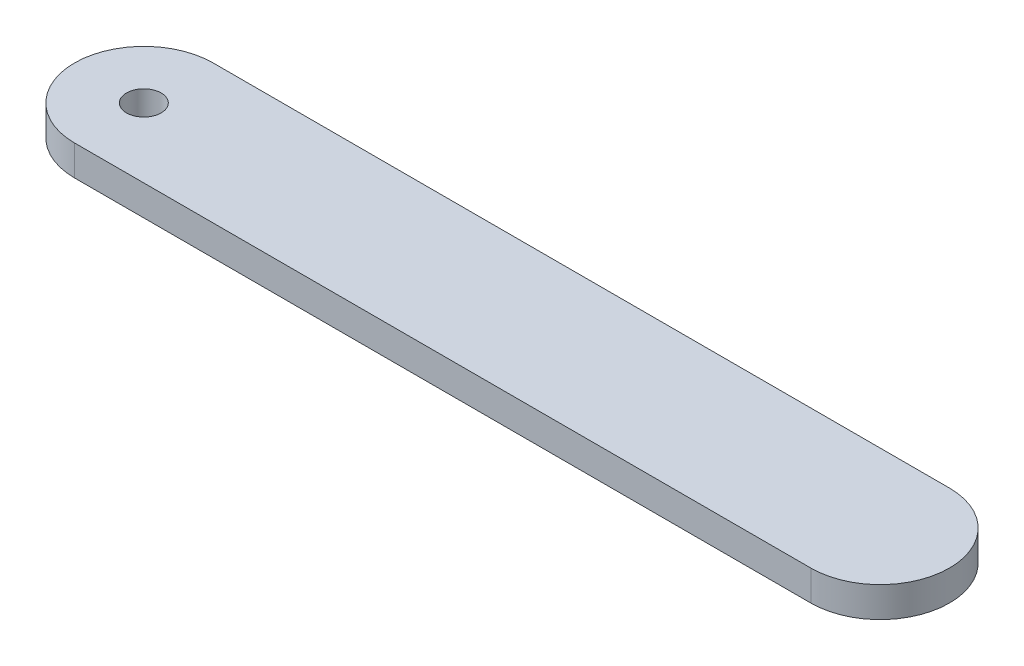
from build123d import *

# Parameters (mm, degrees)
BOSS_EXTRUDE1_DEPTH = 3.5
SKETCH2_R           = 2
CUT_EXTRUDE1_DEPTH  = 3.5


with BuildPart() as part:
    # Sketch1 → Boss-Extrude1 (new body)
    with BuildSketch(Plane(origin=(0, 0, 0), x_dir=(1, 0, 0), z_dir=(0, 1, 0))):
        with BuildLine():
            Line((0, 8), (85, 8))
            ThreePointArc((85, 8), (93, 0), (85, -8))
            Line((85, -8), (0, -8))
            ThreePointArc((0, -8), (-8, 0), (0, 8))
        make_face()
    extrude(amount=BOSS_EXTRUDE1_DEPTH)

    # Sketch2 → Cut-Extrude1 (cut)
    with BuildSketch(Plane(origin=(0, 3.5, 0), x_dir=(1, 0, 0), z_dir=(0, 1, 0))):
        with Locations(Location((0, 0, 0), (0, 0, 270))):
            Circle(SKETCH2_R)
    extrude(amount=-CUT_EXTRUDE1_DEPTH, mode=Mode.SUBTRACT)


solid = part.part
